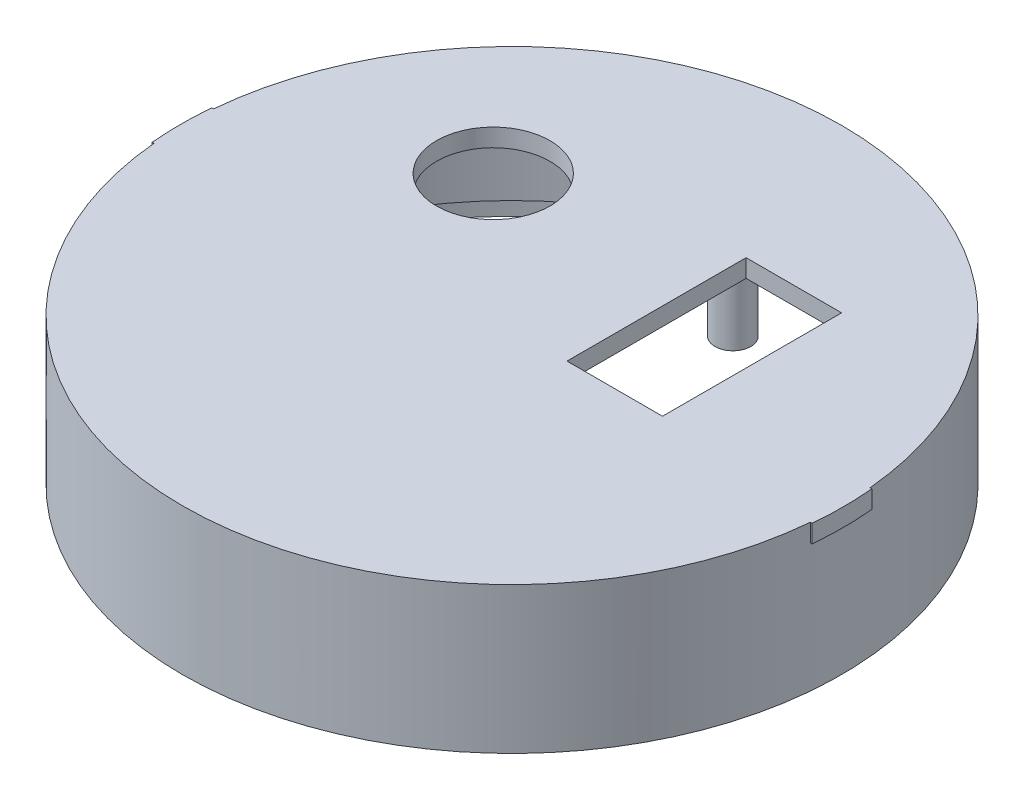
from build123d import *

# Parameters (mm, degrees)
SKETCH1_R                 = 55.2
BOSS_EXTRUDE1_DEPTH       = 3
SKETCH2_R                 = 55
CUT_EXTRUDE1_DEPTH        = 79.12221195
SKETCH4_R                 = 55.2
BOSS_EXTRUDE2_DEPTH       = 18.5
BOSS_EXTRUDE4_DEPTH       = 3
SKETCH6_R                 = 9.5
SKETCH6_W                 = 16
SKETCH6_H                 = 30
BOSS_EXTRUDE3_DEPTH       = 3
BOSS_EXTRUDE9_REACH       = 83.176
SKETCH15_R                = 3
F_3_0MM_DOWEL_HOLE2_D     = 3
F_3_0MM_DOWEL_HOLE2_DEPTH = 14
F_3_0MM_DOWEL_HOLE2_TIP   = 0.901290929


with BuildPart() as part:
    # Sketch1 → Boss-Extrude1 (new body)
    with BuildSketch(Plane(origin=(0, 0, 0), x_dir=(1, 0, 0), z_dir=(0, 1, 0))):
        with Locations(Location((0, 0, 0), (0, 0, 270))):
            Circle(SKETCH1_R)
    extrude(amount=BOSS_EXTRUDE1_DEPTH)

    # Sketch2 → Cut-Extrude1 (cut, through all)
    with BuildSketch(Plane(origin=(0, 3, 0), x_dir=(1, 0, 0), z_dir=(0, 1, 0))):
        with Locations(Location((0, 0, 0), (0, 0, 270))):
            Circle(SKETCH2_R)
    extrude(amount=-CUT_EXTRUDE1_DEPTH, mode=Mode.SUBTRACT)

    # Sketch4 → Boss-Extrude2 (add)
    with BuildSketch(Plane(origin=(0, 3, 0), x_dir=(1, 0, 0), z_dir=(0, 1, 0))):
        with Locations(Location((0, 0, 0), (0, 0, 270))):
            Circle(SKETCH4_R)
        with BuildLine():
            Line((-45.2, -5), (-45.2, 5))
            Line((-45.2, 5), (-53.768020235, 5))
            ThreePointArc((-53.768020235, 5), (54, 0), (-53.768020235, -5))
            Line((-53.768020235, -5), (-45.2, -5))
        make_face(mode=Mode.SUBTRACT)
    extrude(amount=BOSS_EXTRUDE2_DEPTH)

    # Sketch8 → Boss-Extrude4 (add)
    with BuildSketch(Plane.XZ.offset(-3)):
        with BuildLine():
            Line((-45.2, 5), (-54.772255751, 5))
            ThreePointArc((-54.772255751, 5), (-55, 0), (-54.772255751, -5))
            Line((-54.772255751, -5), (-45.2, -5))
            Line((-45.2, -5), (-45.2, 5))
        make_face()
    extrude(amount=BOSS_EXTRUDE4_DEPTH)

    # Sketch6 → Boss-Extrude3 (add)
    with BuildSketch(Plane(origin=(0, 21.5, 0), x_dir=(1, 0, 0), z_dir=(0, 1, 0))):
        with BuildLine():
            Line((-55.274315916, -5), (-54.973084323, -5))
            ThreePointArc((-54.973084323, -5), (0, -55.2), (54.973084323, -5))
            Line((54.973084323, -5), (55.274315916, -5))
            ThreePointArc((55.274315916, -5), (55.5, 0), (55.274315916, 5))
            Line((55.274315916, 5), (54.973084323, 5))
            ThreePointArc((54.973084323, 5), (0, 55.2), (-54.973084323, 5))
            Line((-54.973084323, 5), (-55.274315916, 5))
            ThreePointArc((-55.274315916, 5), (-55.5, 0), (-55.274315916, -5))
        make_face()
        with Locations(Location((-22.20107336, 19.059873591, 0), (0, 0, 270))):
            Circle(SKETCH6_R, mode=Mode.SUBTRACT)
        with Locations((19.213108786, 13)):
            Rectangle(SKETCH6_W, SKETCH6_H, mode=Mode.SUBTRACT)
    extrude(amount=BOSS_EXTRUDE3_DEPTH)

    # Sketch15 → Boss-Extrude9 (add, up to next)
    with BuildSketch(Plane.XZ.offset(-3), mode=Mode.PRIVATE) as boss_extrude9_sk1:
        with Locations(Location((0, 42, 0), (0, 0, 270))):
            Circle(SKETCH15_R)
    boss_extrude9_tool1 = extrude(boss_extrude9_sk1.sketch, amount=-BOSS_EXTRUDE9_REACH, mode=Mode.PRIVATE) - part.part
    # Sketch15 → Boss-Extrude9 (add, up to next)
    with BuildSketch(Plane.XZ.offset(-3), mode=Mode.PRIVATE) as boss_extrude9_sk2:
        with Locations(Location((0, -37, 0), (0, 0, 90))):
            Circle(SKETCH15_R)
    boss_extrude9_tool2 = extrude(boss_extrude9_sk2.sketch, amount=-BOSS_EXTRUDE9_REACH, mode=Mode.PRIVATE) - part.part
    add(boss_extrude9_tool1.solids().sort_by_distance((0, 3, 42))[0])
    add(boss_extrude9_tool2.solids().sort_by_distance((0, 3, -37))[0])

    # Ø3.0mm Dowel Hole2
    with Locations(Plane(origin=(0, 3, 42), x_dir=(0, 0, -1), z_dir=(0, -1, 0))):
        with Locations((0, 0), (79, 0)):
            Hole(F_3_0MM_DOWEL_HOLE2_D / 2, depth=F_3_0MM_DOWEL_HOLE2_DEPTH)
            with Locations((0, 0, -(F_3_0MM_DOWEL_HOLE2_DEPTH + F_3_0MM_DOWEL_HOLE2_TIP / 2))):  # 118° drill point
                Cone(0, F_3_0MM_DOWEL_HOLE2_D / 2, F_3_0MM_DOWEL_HOLE2_TIP, mode=Mode.SUBTRACT)


solid = part.part
